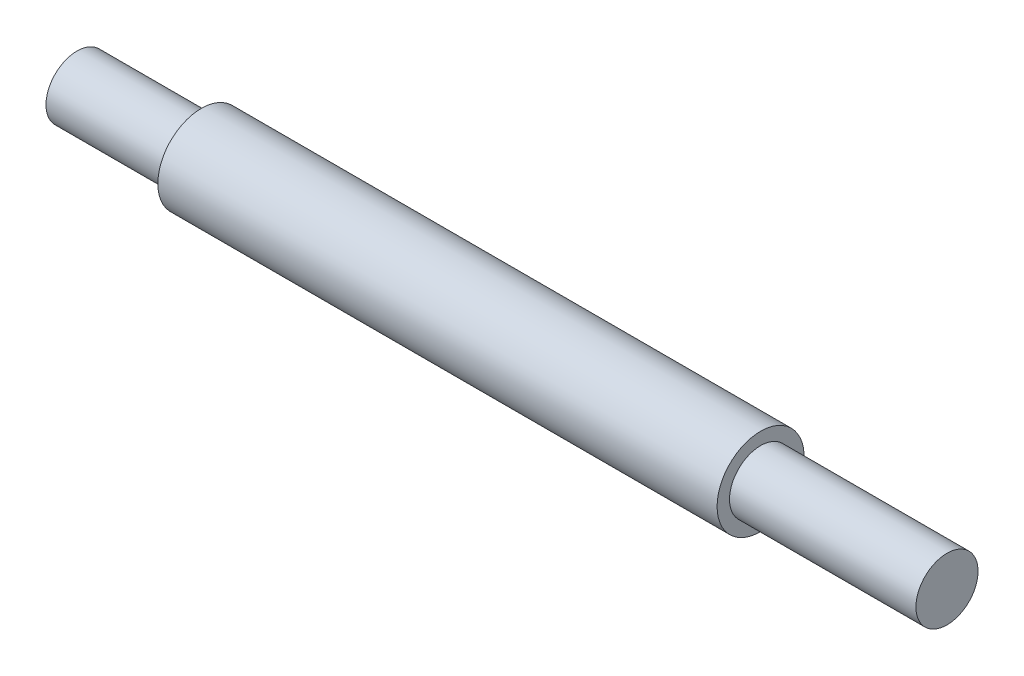
from build123d import *


with BuildPart() as part:
    # Sketch1 → Revolve1 (revolve)
    with BuildSketch(Plane(origin=(0, 0, 0), x_dir=(1, 0, 0), z_dir=(0, 1, 0)), mode=Mode.PRIVATE) as revolve1_sk:
        Polygon((0, 0), (700, 0), (700, 25), (550, 25), (550, 35), (100, 35), (100, 25), (0, 25), align=None)
    revolve(revolve1_sk.sketch.rotate(Axis((0, 0, 0), (1, 0, 0)), 180), axis=Axis((0, 0, 0), (1, 0, 0)))


solid = part.part
